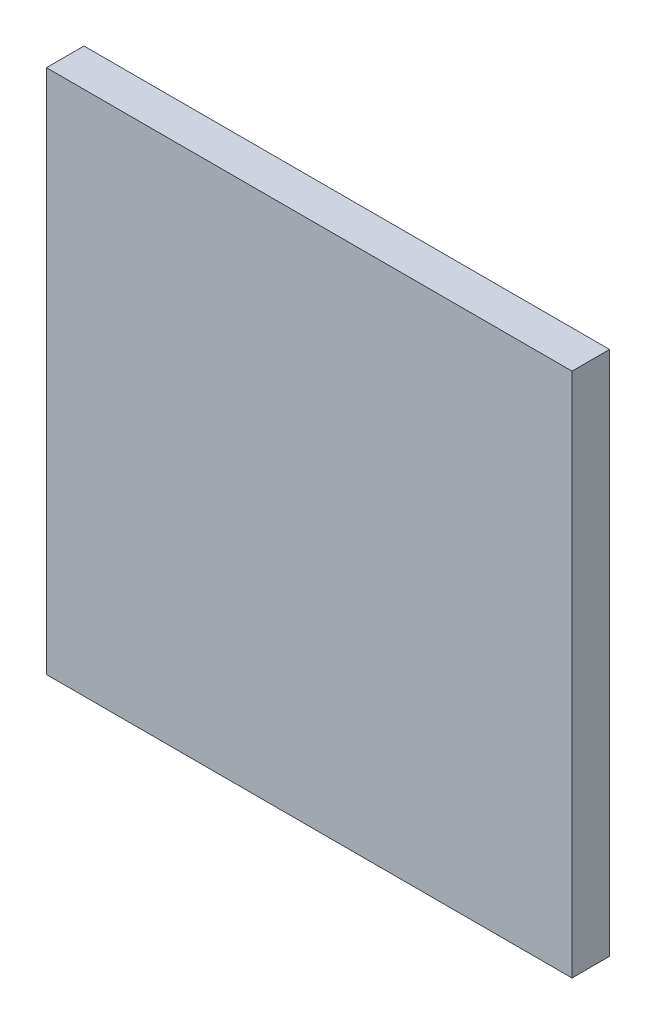
from build123d import *

# Parameters (mm, degrees)
SKETCH1_W           = 140
SKETCH1_H           = 140
BOSS_EXTRUDE1_DEPTH = 10
SKETCH2_R           = 5
BOSS_EXTRUDE2_DEPTH = 30


with BuildPart() as part:
    # Sketch1 → Boss-Extrude1 (new body)
    with BuildSketch(Plane.XY):
        Rectangle(SKETCH1_W, SKETCH1_H)
    extrude(amount=BOSS_EXTRUDE1_DEPTH)

    # Sketch2 → Boss-Extrude2 (add)
    with BuildSketch(Plane.XY):
        with Locations((-31.9, 0)):
            Circle(SKETCH2_R)
        with Locations((31.9, 0)):
            Circle(SKETCH2_R)
    extrude(amount=-BOSS_EXTRUDE2_DEPTH)


solid = part.part
